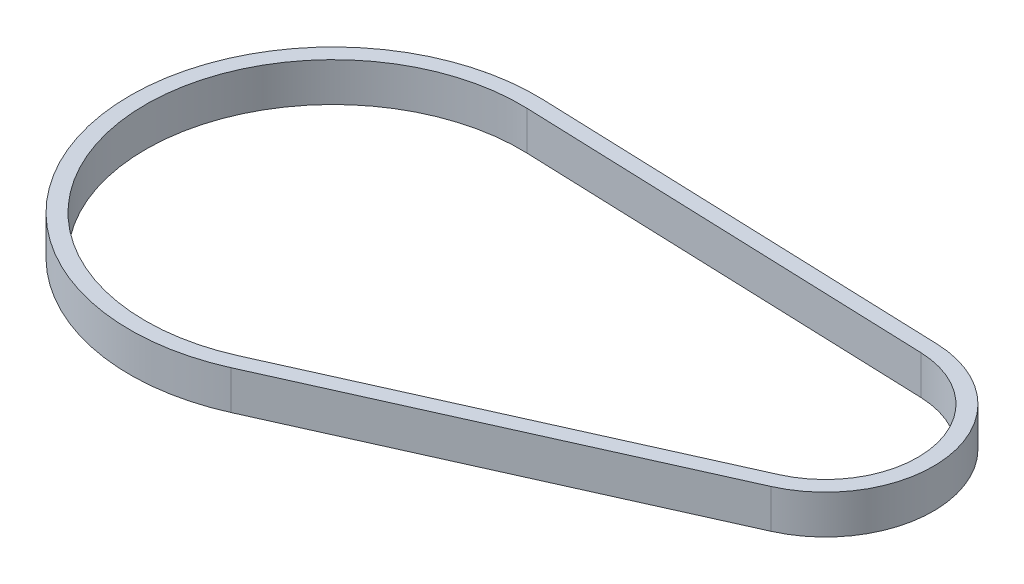
from build123d import *

# Parameters (mm, degrees)
BOSS_EXTRUDE1_DEPTH = 10


with BuildPart() as part:
    # Sketch1 → Boss-Extrude1 (new body)
    with BuildSketch(Plane(origin=(0, 0, 0), x_dir=(1, 0, 0), z_dir=(0, 1, 0))):
        with BuildLine():
            Line((1.875116136, 52.226349092), (106.996401968, 48.452112089))
            ThreePointArc((106.996401968, 48.452112089), (133.265104259, 26.011927778), (117.363223434, -4.65950483))
            Line((117.363223434, -4.65950483), (21.377279195, -47.687729388))
            ThreePointArc((21.377279195, -47.687729388), (-51.292048524, -10.011661111), (1.875116136, 52.226349092))
        make_face()
        with BuildLine():
            Line((1.731594043, 48.228924745), (106.852879876, 44.454687742))
            ThreePointArc((106.852879876, 44.454687742), (129.339191628, 25.245631481), (115.726998467, -1.009468137))
            Line((115.726998467, -1.009468137), (19.741054228, -44.037692696))
            ThreePointArc((19.741054228, -44.037692696), (-47.366135893, -9.245364815), (1.731594043, 48.228924745))
        make_face(mode=Mode.SUBTRACT)
    extrude(amount=BOSS_EXTRUDE1_DEPTH)


solid = part.part
